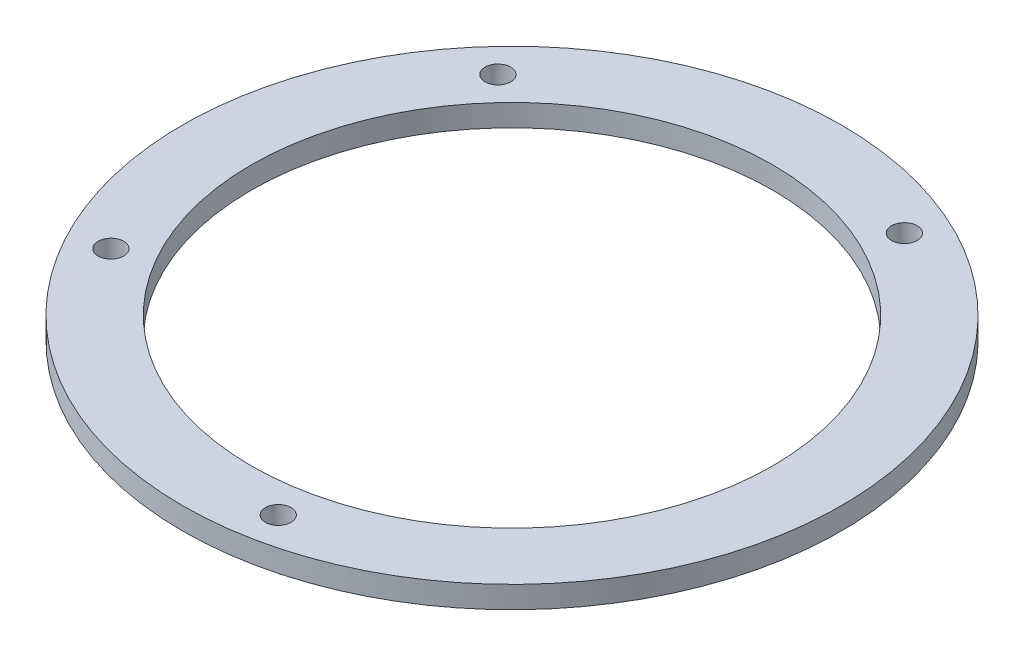
from build123d import *

# Parameters (mm, degrees)
SKETCH1_R           = 45
SKETCH1_R_2         = 35.6
SKETCH1_R_3         = 1.75
BOSS_EXTRUDE1_DEPTH = 3


with BuildPart() as part:
    # Sketch1 → Boss-Extrude1 (new body)
    with BuildSketch(Plane(origin=(0, 0, 0), x_dir=(1, 0, 0), z_dir=(0, 1, 0))):
        with Locations(Location((0, 0, 0), (0, 0, 270))):
            Circle(SKETCH1_R)
        with Locations(Location((0, 0, 0), (0, 0, 270))):
            Circle(SKETCH1_R_2, mode=Mode.SUBTRACT)
        with Locations(Location((-29.444807033, 27.51532916, 0), (0, 0, 270))):
            Circle(SKETCH1_R_3, mode=Mode.SUBTRACT)
        with Locations(Location((-35.267578865, -19.500971284, 0), (0, 0, 270))):
            Circle(SKETCH1_R_3, mode=Mode.SUBTRACT)
        with Locations(Location((7.648244594, -39.567592227, 0), (0, 0, 270))):
            Circle(SKETCH1_R_3, mode=Mode.SUBTRACT)
        with Locations(Location((17.069687326, 36.506379916, 0), (0, 0, 270))):
            Circle(SKETCH1_R_3, mode=Mode.SUBTRACT)
    extrude(amount=BOSS_EXTRUDE1_DEPTH)


solid = part.part
